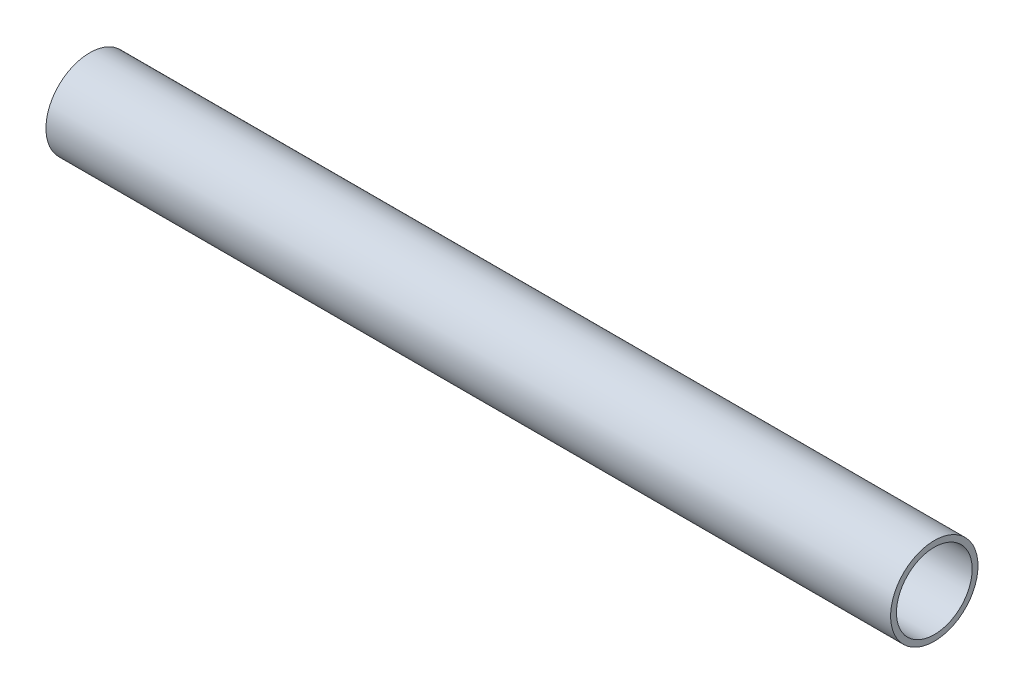
from build123d import *

# Parameters (mm, degrees)
SKETCH1_R           = 7.5
SKETCH1_R_2         = 6.5
BOSS_EXTRUDE1_DEPTH = 145


with BuildPart() as part:
    # Sketch1 → Boss-Extrude1 (new body)
    with BuildSketch(Plane(origin=(0, 0, 0), x_dir=(0, 0, -1), z_dir=(1, 0, 0))):
        Circle(SKETCH1_R)
        Circle(SKETCH1_R_2, mode=Mode.SUBTRACT)
    extrude(amount=BOSS_EXTRUDE1_DEPTH)


solid = part.part
